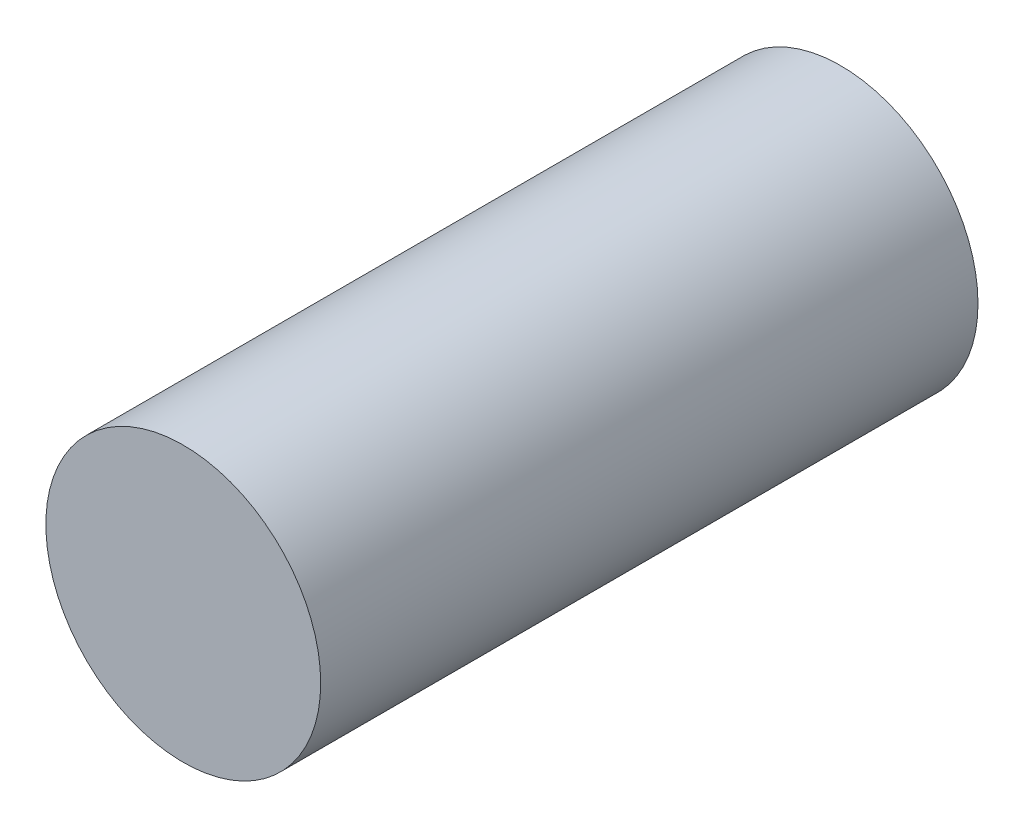
from build123d import *

# Parameters (mm, degrees)
SKETCH1_R      = 10.62101
EXTRUDE1_DEPTH = 25.4


with BuildPart() as part:
    # Sketch1 → Extrude1 (new, symmetric)
    with BuildSketch(Plane.XY):
        with Locations((-0.260648899, 10.617811242)):
            Circle(SKETCH1_R)
    extrude(amount=EXTRUDE1_DEPTH, both=True)


solid = part.part
